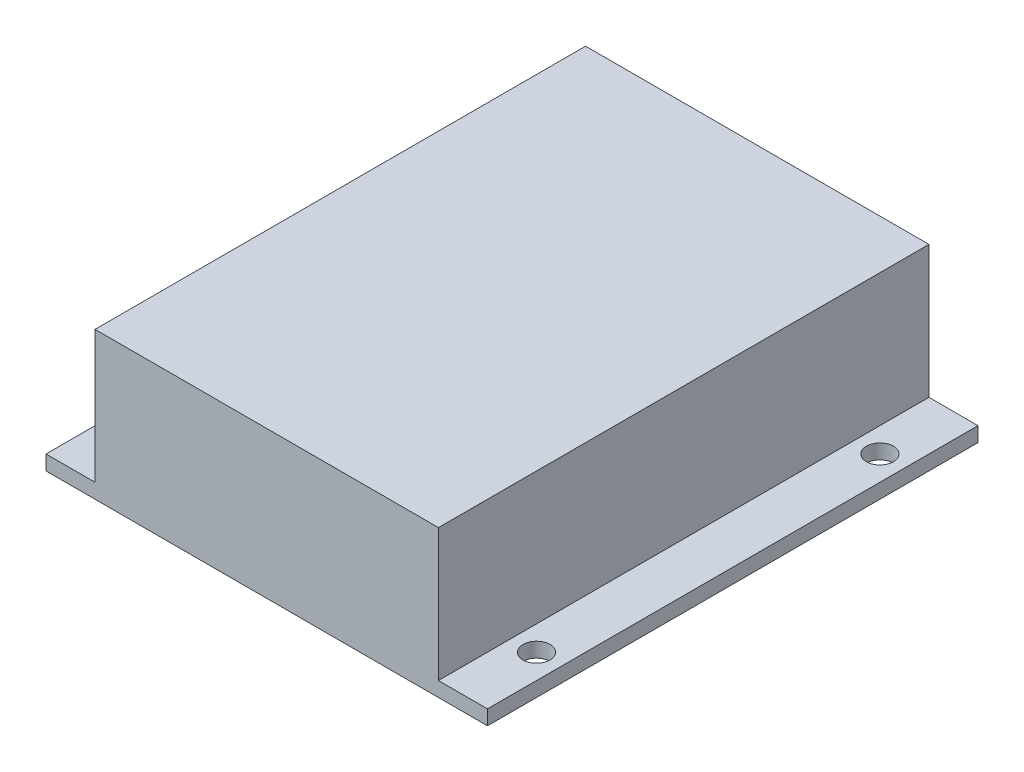
from build123d import *

# Parameters (mm, degrees)
SKETCH1_W                = 70
SKETCH1_H                = 100
BOSS_EXTRUDE1_DEPTH      = 30
BOSS_EXTRUDE3_DEPTH      = 3
M5_CLEARANCE_SLOT1_D     = 5.5
M5_CLEARANCE_SLOT1_DEPTH = 22.25
M5_CLEARANCE_SLOT1_TIP   = 1.652366702


with BuildPart() as part:
    # Sketch1 → Boss-Extrude1 (new body)
    with BuildSketch(Plane(origin=(0, 0, 0), x_dir=(1, 0, 0), z_dir=(0, 1, 0))):
        Rectangle(SKETCH1_W, SKETCH1_H)
    extrude(amount=BOSS_EXTRUDE1_DEPTH)

    # Sketch1<4> → Boss-Extrude3 (add)
    with BuildSketch(Plane(origin=(0, 0, 0), x_dir=(1, 0, 0), z_dir=(0, 1, 0))):
        Polygon((-35, -50), (-35, 50), (-45, 50), (-45, 35), (-45, -35), (-45, -50), align=None)
        Polygon((45, 35), (45, 50), (35, 50), (35, -50), (45, -50), (45, -35), align=None)
    extrude(amount=BOSS_EXTRUDE3_DEPTH)

    # M5 Clearance Slot1
    with Locations(Plane(origin=(0, 0, 0), x_dir=(-1, 0, 0), z_dir=(0, -1, 0))):
        with Locations((40, 35), (40, -35), (-40, 35), (-40, -35)):
            Hole(M5_CLEARANCE_SLOT1_D / 2, depth=M5_CLEARANCE_SLOT1_DEPTH)
            with Locations((0, 0, -(M5_CLEARANCE_SLOT1_DEPTH + M5_CLEARANCE_SLOT1_TIP / 2))):  # 118° drill point
                Cone(0, M5_CLEARANCE_SLOT1_D / 2, M5_CLEARANCE_SLOT1_TIP, mode=Mode.SUBTRACT)


solid = part.part
